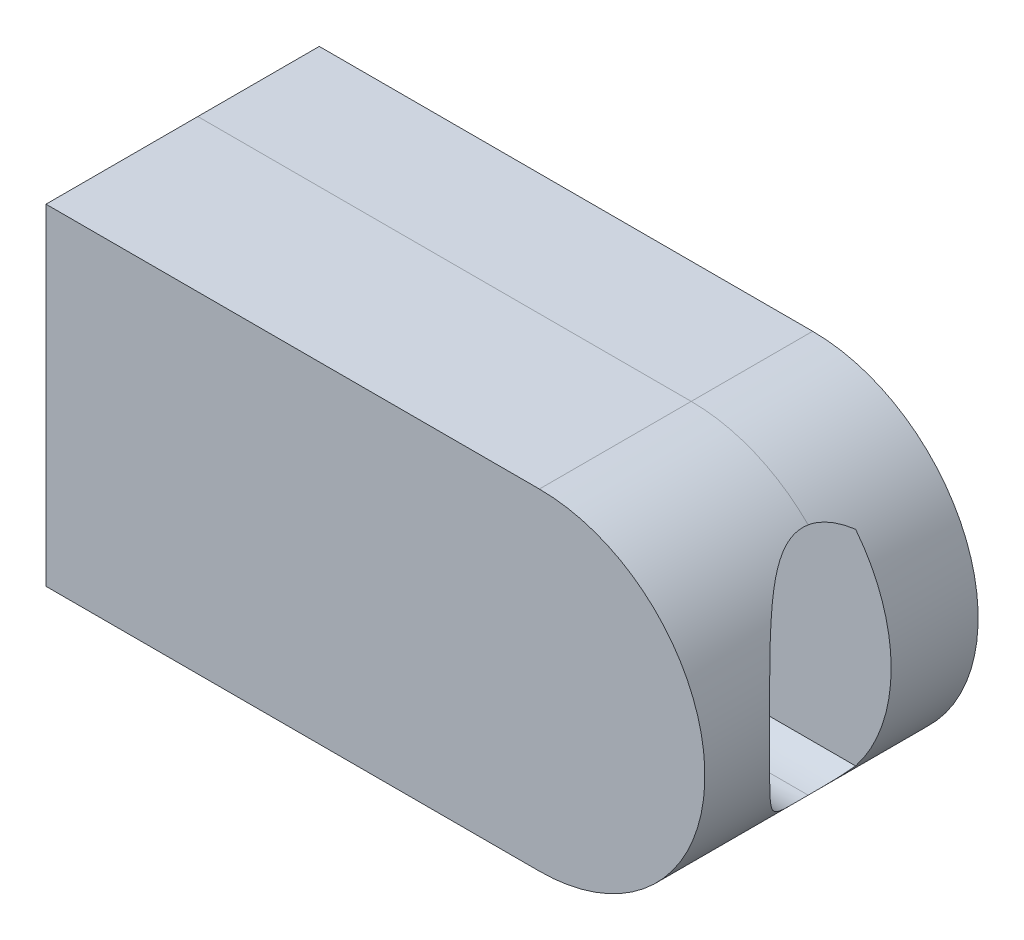
from build123d import *

# Parameters (mm, degrees)
ESTRUSIONE_ESTRUSIONE1_DEPTH  = 36
TAGLIO_ESTRUSIONE1_DEPTH      = 1
TAGLIO_ESTRUSIONE1_DEPTH_BACK = 92
SCHIZZO8_W                    = 25.4
SCHIZZO8_H                    = 25.4
TAGLIO_ESTRUSIONE2_DEPTH      = 1
SCHIZZO10_W                   = 2.65
SCHIZZO10_H                   = 17.4
TAGLIO_ESTRUSIONE3_DEPTH      = 25
SCHIZZO14_W                   = 44.417937998
SCHIZZO14_H                   = 17.4
TAGLIO_ESTRUSIONE5_DEPTH      = 5


with BuildPart() as part:
    # Schizzo1 → Estrusione-Estrusione1 (new body)
    with BuildSketch(Plane.XY):
        with BuildLine():
            Line((-31.770573566, 22.612219451), (33.229426434, 22.612219451))
            ThreePointArc((33.229426434, 22.612219451), (55.03117207, 0.810473815), (33.229426434, -20.99127182))
            Line((33.229426434, -20.99127182), (-31.770573566, -20.99127182))
            Line((-31.770573566, -20.99127182), (-31.770573566, 22.612219451))
        make_face()
    extrude(amount=ESTRUSIONE_ESTRUSIONE1_DEPTH)

    # Schizzo6 → Taglio-Estrusione1 (cut, two sides: drawn at the far end of the back side and taken through both)
    with BuildSketch(Plane.ZY.offset(31.770573566).offset(-TAGLIO_ESTRUSIONE1_DEPTH_BACK)):
        with BuildLine():
            Line((11.459722367, 14.310835411), (11.459722367, -12.68988778))
            add(Edge.make_bspline(
                [(11.459722367, -12.68988778), (14.702499557, -15.282629715), (20.39322805, -16.919759668), (25.687174992, -12.452872294), (27.459722367, -4.518434658), (27.459722367, 6.139382289), (25.687174992, 14.073819925), (20.39322805, 18.540707299), (14.702499557, 16.903577345), (11.459722367, 14.310835411)],
                knots=[2.633464466, 2.633464466, 2.633464466, 2.633464466, 2.633464466, 2.633464466, 4.71238898, 4.71238898, 4.71238898, 4.71238898, 6.791313494, 6.791313494, 6.791313494, 6.791313494, 6.791313494, 6.791313494], degree=5, weights=[1, 1, 0.902655704, 0.902655704, 1, 1, 0.902655704, 0.902655704, 1, 1]))
        make_face()
    extrude(amount=TAGLIO_ESTRUSIONE1_DEPTH + TAGLIO_ESTRUSIONE1_DEPTH_BACK, mode=Mode.SUBTRACT)


with BuildPart() as body_2:
    # Dividi4: the piece on the far side of the plane
    add(part.part)
    split(bisect_by=Plane.XY.offset(16), keep=Keep.BOTTOM)

    # Schizzo8 → Taglio-Estrusione2 (cut)
    with BuildSketch(Plane.XY.offset(11.459722367)):
        with Locations((24.33117207, 0.810835411)):
            Rectangle(SCHIZZO8_W, SCHIZZO8_H)
    extrude(amount=-TAGLIO_ESTRUSIONE2_DEPTH, mode=Mode.SUBTRACT)

    # Schizzo10 → Taglio-Estrusione3 (cut)
    with BuildSketch(Plane.XY.offset(10.459722367)):
        with Locations((13.972364432, 0.810835411)):
            Rectangle(SCHIZZO10_W, SCHIZZO10_H)
    extrude(amount=-TAGLIO_ESTRUSIONE3_DEPTH, mode=Mode.SUBTRACT)

    # Schizzo14 → Taglio-Estrusione5 (cut)
    with BuildSketch(Plane(origin=(0, 0, 0), x_dir=(-1, 0, 0), z_dir=(0, 0, -1))):
        with Locations((9.561604567, 0.810835411)):
            Rectangle(SCHIZZO14_W, SCHIZZO14_H)
    extrude(amount=-TAGLIO_ESTRUSIONE5_DEPTH, mode=Mode.SUBTRACT)


with BuildPart() as part_1:
    add(part.part)

    # Dividi4
    split(bisect_by=Plane.XY.offset(16), keep=Keep.TOP)


solid = Compound([body_2.part, part_1.part])
